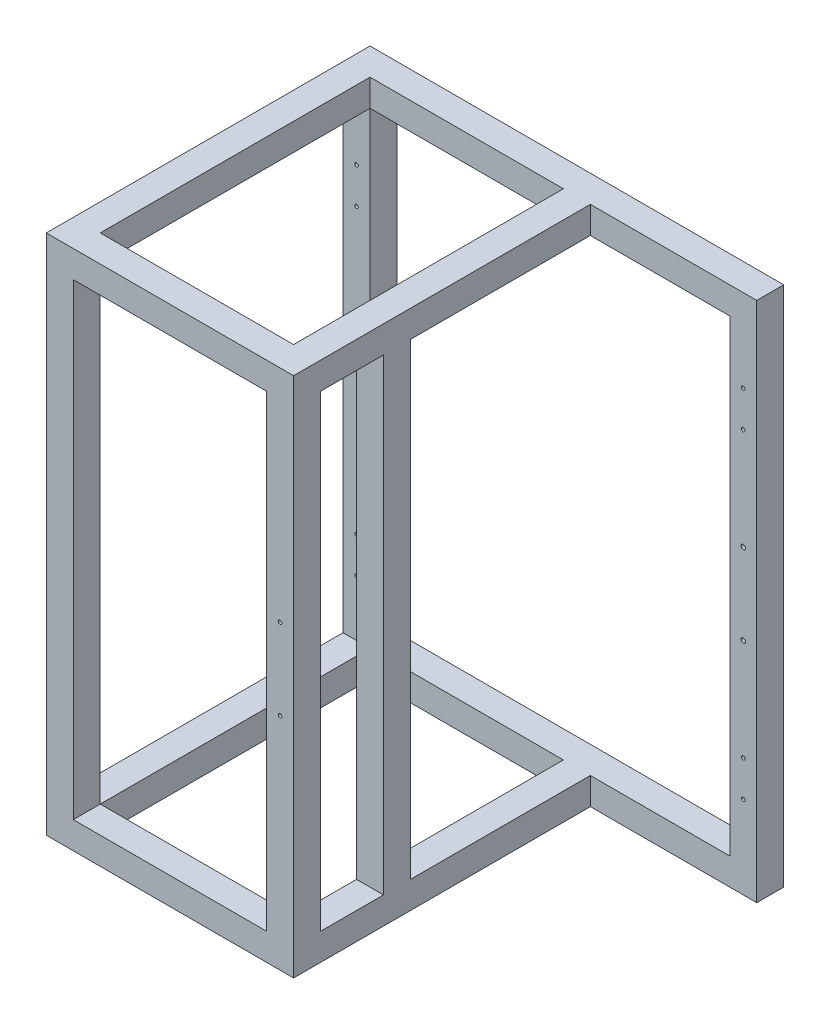
from build123d import *

# Parameters (mm, degrees)
SZKIC1_W                    = 460
SZKIC1_H                    = 580
SZKIC1_W_2                  = 400
SZKIC1_H_2                  = 520
DODANIE_WYCI_GNI_CIE1_DEPTH = 30
SZKIC4_R                    = 2.5
WYTNIJ_WYCI_GNI_CIE2_DEPTH  = 5
SZKIC5_W                    = 30
SZKIC5_H                    = 30
DODANIE_WYCI_GNI_CIE3_DEPTH = 330
DODANIE_WYCI_GNI_CIE4_REACH = 698.419
SZKIC6_W                    = 30
SZKIC6_H                    = 30
DODANIE_WYCI_GNI_CIE5_REACH = 698.419
SZKIC7_W                    = 30
SZKIC7_H                    = 30
SZKIC8_W                    = 30
SZKIC8_H                    = 30
DODANIE_WYCI_GNI_CIE6_DEPTH = 330
DODANIE_WYCI_GNI_CIE7_REACH = 633.348
SZKIC9_W                    = 30
SZKIC9_H                    = 30
DODANIE_WYCI_GNI_CIE8_REACH = 698.419
SZKIC10_W                   = 30
SZKIC10_H                   = 30
SZKIC11_R                   = 2
WYTNIJ_WYCI_GNI_CIE3_DEPTH  = 5
SZKIC12_R                   = 2
WYTNIJ_WYCI_GNI_CIE4_DEPTH  = 5
SZKIC2_R                    = 2
WYTNIJ_WYCI_GNI_CIE5_DEPTH  = 5
LUSTRO2_COPY_1_SKETCH_R     = 2
LUSTRO2_COPY_1_DEPTH        = 5


with BuildPart() as part:
    # Szkic1 → Dodanie-wyciągnięcie1 (new body)
    with BuildSketch(Plane.XY):
        Rectangle(SZKIC1_W, SZKIC1_H)
        Rectangle(SZKIC1_W_2, SZKIC1_H_2, mode=Mode.SUBTRACT)
    extrude(amount=DODANIE_WYCI_GNI_CIE1_DEPTH)

    # Szkic4 → Wytnij-wyciągnięcie2 (cut)
    with BuildSketch(Plane.XY.offset(30)):
        with Locations((215, 45)):
            Circle(SZKIC4_R)
        with Locations((215, -45)):
            Circle(SZKIC4_R)
    extrude(amount=-WYTNIJ_WYCI_GNI_CIE2_DEPTH, mode=Mode.SUBTRACT)

    # Szkic5 → Dodanie-wyciągnięcie3 (add)
    with BuildSketch(Plane.XY.offset(30)):
        with Locations((30, -275)):
            Rectangle(SZKIC5_W, SZKIC5_H)
        with Locations((30, 275)):
            Rectangle(SZKIC5_W, SZKIC5_H)
    extrude(amount=DODANIE_WYCI_GNI_CIE3_DEPTH)

    # Szkic6 → Dodanie-wyciągnięcie4 (add, up to next)
    with BuildSketch(Plane.XZ.offset(-260), mode=Mode.PRIVATE) as dodanie_wyci_gni_cie4_sk1:
        with Locations((30, 245)):
            Rectangle(SZKIC6_W, SZKIC6_H)
    dodanie_wyci_gni_cie4_tool1 = extrude(dodanie_wyci_gni_cie4_sk1.sketch, amount=DODANIE_WYCI_GNI_CIE4_REACH, mode=Mode.PRIVATE) - part.part
    add(dodanie_wyci_gni_cie4_tool1.solids().sort_by_distance((30, 260, 245))[0])

    # Szkic7 → Dodanie-wyciągnięcie5 (add, up to next)
    with BuildSketch(Plane(origin=(0, 260, 0), x_dir=(-1, 0, 0), z_dir=(0, -1, 0)), mode=Mode.PRIVATE) as dodanie_wyci_gni_cie5_sk1:
        with Locations((-30, -345)):
            Rectangle(SZKIC7_W, SZKIC7_H)
    dodanie_wyci_gni_cie5_tool1 = extrude(dodanie_wyci_gni_cie5_sk1.sketch, amount=DODANIE_WYCI_GNI_CIE5_REACH, mode=Mode.PRIVATE) - part.part
    add(dodanie_wyci_gni_cie5_tool1.solids().sort_by_distance((30, 260, 345))[0])

    # Szkic8 → Dodanie-wyciągnięcie6 (add)
    with BuildSketch(Plane.XY.offset(30)):
        with Locations((-215, 275)):
            Rectangle(SZKIC8_W, SZKIC8_H)
        with Locations((-215, -275)):
            Rectangle(SZKIC8_W, SZKIC8_H)
    extrude(amount=DODANIE_WYCI_GNI_CIE6_DEPTH)

    # Szkic9 → Dodanie-wyciągnięcie7 (add, up to next)
    with BuildSketch(Plane(origin=(-200, 0, 0), x_dir=(0, 0, -1), z_dir=(1, 0, 0)), mode=Mode.PRIVATE) as dodanie_wyci_gni_cie7_sk1:
        with Locations((-345, 275)):
            Rectangle(SZKIC9_W, SZKIC9_H)
    dodanie_wyci_gni_cie7_tool1 = extrude(dodanie_wyci_gni_cie7_sk1.sketch, amount=DODANIE_WYCI_GNI_CIE7_REACH, mode=Mode.PRIVATE) - part.part
    # Szkic9 → Dodanie-wyciągnięcie7 (add, up to next)
    with BuildSketch(Plane(origin=(-200, 0, 0), x_dir=(0, 0, -1), z_dir=(1, 0, 0)), mode=Mode.PRIVATE) as dodanie_wyci_gni_cie7_sk2:
        with Locations((-345, -275)):
            Rectangle(SZKIC9_W, SZKIC9_H)
    dodanie_wyci_gni_cie7_tool2 = extrude(dodanie_wyci_gni_cie7_sk2.sketch, amount=DODANIE_WYCI_GNI_CIE7_REACH, mode=Mode.PRIVATE) - part.part
    add(dodanie_wyci_gni_cie7_tool1.solids().sort_by_distance((-200, 275, 345))[0])
    add(dodanie_wyci_gni_cie7_tool2.solids().sort_by_distance((-200, -275, 345))[0])

    # Szkic10 → Dodanie-wyciągnięcie8 (add, up to next)
    with BuildSketch(Plane.XZ.offset(-260), mode=Mode.PRIVATE) as dodanie_wyci_gni_cie8_sk1:
        with Locations((-215, 345)):
            Rectangle(SZKIC10_W, SZKIC10_H)
    dodanie_wyci_gni_cie8_tool1 = extrude(dodanie_wyci_gni_cie8_sk1.sketch, amount=DODANIE_WYCI_GNI_CIE8_REACH, mode=Mode.PRIVATE) - part.part
    add(dodanie_wyci_gni_cie8_tool1.solids().sort_by_distance((-215, 260, 345))[0])

    # Szkic11 → Wytnij-wyciągnięcie3 (cut)
    with BuildSketch(Plane.ZY.offset(-15)):
        with Locations((245, 25)):
            Circle(SZKIC11_R)
        with Locations((245, -25)):
            Circle(SZKIC11_R)
    extrude(amount=-WYTNIJ_WYCI_GNI_CIE3_DEPTH, mode=Mode.SUBTRACT)

    # Szkic12 → Wytnij-wyciągnięcie4 (cut)
    with BuildSketch(Plane.XY.offset(360)):
        with Locations((30, -45)):
            Circle(SZKIC12_R)
        with Locations((30, 45)):
            Circle(SZKIC12_R)
    extrude(amount=-WYTNIJ_WYCI_GNI_CIE4_DEPTH, mode=Mode.SUBTRACT)

    # Szkic2 → Wytnij-wyciągnięcie5 (cut)
    with BuildSketch(Plane.XY.offset(30)):
        with Locations((215, 198)):
            Circle(SZKIC2_R)
        with Locations((215, 158)):
            Circle(SZKIC2_R)
    wytnij_wyci_gni_cie5 = extrude(amount=-WYTNIJ_WYCI_GNI_CIE5_DEPTH, mode=Mode.SUBTRACT)

    # Lustro1: Wytnij-wyciągnięcie5 across plane
    add(wytnij_wyci_gni_cie5.mirror(Plane(origin=(0, 0, 0), x_dir=(0, 0, 1), z_dir=(1, 0, 0))), mode=Mode.SUBTRACT)

    # Lustro2: Wytnij-wyciągnięcie5 across plane
    add(wytnij_wyci_gni_cie5.mirror(Plane.ZX), mode=Mode.SUBTRACT)

    # Lustro2 copy 1 sketch → Lustro2 copy 1 (cut)
    with BuildSketch(Plane(origin=(0, 0, 30), x_dir=(-1, 0, 0), z_dir=(0, 0, 1))):
        with Locations((215, 198)):
            Circle(LUSTRO2_COPY_1_SKETCH_R)
        with Locations((215, 158)):
            Circle(LUSTRO2_COPY_1_SKETCH_R)
    extrude(amount=-LUSTRO2_COPY_1_DEPTH, mode=Mode.SUBTRACT)


solid = part.part
